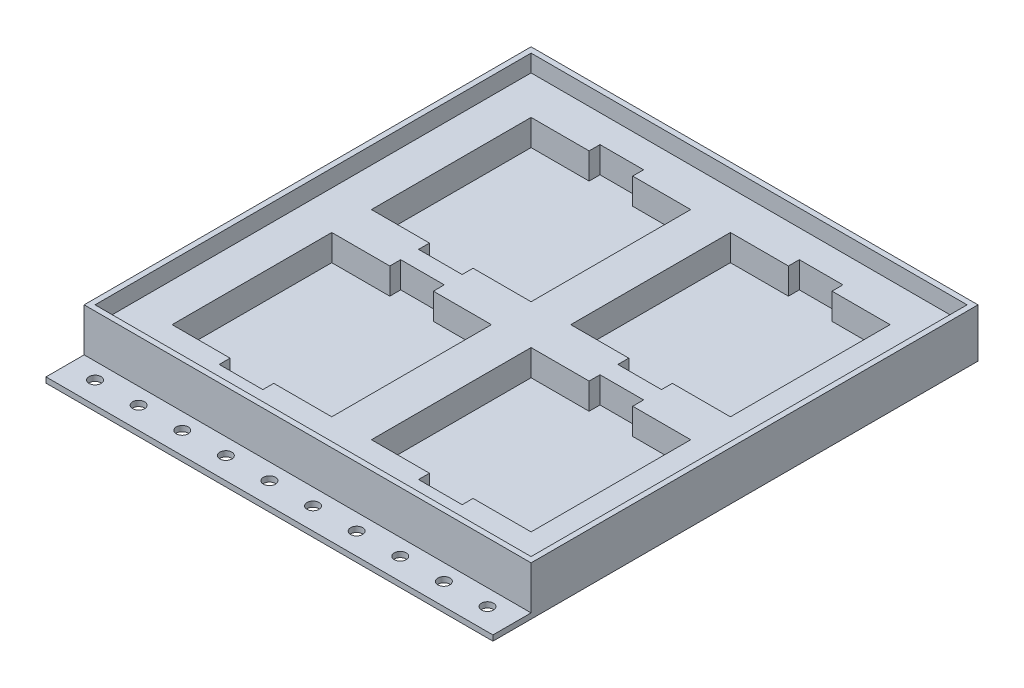
from build123d import *

# Parameters (mm, degrees)
SKETCH1_W           = 304.8
SKETCH1_H           = 304.8
SKETCH1_W_2         = 93
SKETCH1_H_2         = 93
BOSS_EXTRUDE1_DEPTH = 15.24
SKETCH2_W           = 304.8
SKETCH2_H           = 304.8
BOSS_EXTRUDE2_DEPTH = 3.175
SKETCH3_W           = 304.8
SKETCH3_H           = 304.8
SKETCH3_W_2         = 254
SKETCH3_H_2         = 254
BOSS_EXTRUDE3_DEPTH = 10
SKETCH4_OUTSIDE_W   = 393.198
SKETCH4_OUTSIDE_H   = 393.198
SKETCH4_OUTSIDE_W_2 = 260.35
SKETCH4_OUTSIDE_H_2 = 260.35
CUT_EXTRUDE1_DEPTH  = 25.24
SKETCH5_R           = 3.4925
CUT_EXTRUDE2_DEPTH  = 217.999026726
SKETCH6_W           = 25.4
SKETCH6_H           = 6.35
CUT_EXTRUDE3_DEPTH  = 15.24
SKETCH7_W           = 388.208697242
SKETCH7_H           = 185.968986832
CUT_EXTRUDE4_DEPTH  = 323.042618647
SKETCH8_W           = 545.051384684
SKETCH8_H           = 463.265958
CUT_EXTRUDE5_DEPTH  = 323.042618647
SKETCH9_W           = 585.539242267
SKETCH9_H           = 383.639310532
CUT_EXTRUDE6_DEPTH  = 303.729153039


with BuildPart() as part:
    # Sketch1 → Boss-Extrude1 (new body)
    with BuildSketch(Plane(origin=(0, 0, 0), x_dir=(1, 0, 0), z_dir=(0, 1, 0))):
        Rectangle(SKETCH1_W, SKETCH1_H)
        with Locations((58.057, 58.057)):
            Rectangle(SKETCH1_W_2, SKETCH1_H_2, mode=Mode.SUBTRACT)
        with Locations((-58.057, 58.057)):
            Rectangle(SKETCH1_W_2, SKETCH1_H_2, mode=Mode.SUBTRACT)
        with Locations((-58.057, -58.057)):
            Rectangle(SKETCH1_W_2, SKETCH1_H_2, mode=Mode.SUBTRACT)
        with Locations((58.057, -58.057)):
            Rectangle(SKETCH1_W_2, SKETCH1_H_2, mode=Mode.SUBTRACT)
    extrude(amount=BOSS_EXTRUDE1_DEPTH)

    # Sketch2 → Boss-Extrude2 (add)
    with BuildSketch(Plane(origin=(0, 0, 0), x_dir=(-1, 0, 0), z_dir=(0, -1, 0))):
        Rectangle(SKETCH2_W, SKETCH2_H)
    extrude(amount=BOSS_EXTRUDE2_DEPTH)

    # Sketch3 → Boss-Extrude3 (add)
    with BuildSketch(Plane(origin=(0, 15.24, 0), x_dir=(1, 0, 0), z_dir=(0, 1, 0))):
        Rectangle(SKETCH3_W, SKETCH3_H)
        Rectangle(SKETCH3_W_2, SKETCH3_H_2, mode=Mode.SUBTRACT)
    extrude(amount=BOSS_EXTRUDE3_DEPTH)

    # Sketch4 outside → Cut-Extrude1 (cut)
    with BuildSketch(Plane(origin=(0, 25.24, 0), x_dir=(1, 0, 0), z_dir=(0, 1, 0))):
        Rectangle(SKETCH4_OUTSIDE_W, SKETCH4_OUTSIDE_H)
        Rectangle(SKETCH4_OUTSIDE_W_2, SKETCH4_OUTSIDE_H_2, mode=Mode.SUBTRACT)
    extrude(amount=-CUT_EXTRUDE1_DEPTH, mode=Mode.SUBTRACT)

    # Sketch5 → Cut-Extrude2 (cut, through all)
    with BuildSketch(Plane(origin=(0, 0, 0), x_dir=(1, 0, 0), z_dir=(0, 1, 0))):
        with Locations(Location((-139.7, -139.7, 0), (0, 0, 270))):
            Circle(SKETCH5_R)
        with Locations(Location((-114.3, -139.7, 0), (0, 0, 270))):
            Circle(SKETCH5_R)
        with Locations(Location((-88.9, -139.7, 0), (0, 0, 270))):
            Circle(SKETCH5_R)
        with Locations(Location((-63.5, -139.7, 0), (0, 0, 270))):
            Circle(SKETCH5_R)
        with Locations(Location((-38.1, -139.7, 0), (0, 0, 270))):
            Circle(SKETCH5_R)
        with Locations(Location((-12.7, -139.7, 0), (0, 0, 270))):
            Circle(SKETCH5_R)
        with Locations(Location((12.7, -139.7, 0), (0, 0, 270))):
            Circle(SKETCH5_R)
        with Locations(Location((38.1, -139.7, 0), (0, 0, 270))):
            Circle(SKETCH5_R)
        with Locations(Location((63.5, -139.7, 0), (0, 0, 270))):
            Circle(SKETCH5_R)
        with Locations(Location((88.9, -139.7, 0), (0, 0, 270))):
            Circle(SKETCH5_R)
        with Locations(Location((114.3, -139.7, 0), (0, 0, 270))):
            Circle(SKETCH5_R)
        with Locations(Location((139.7, -139.7, 0), (0, 0, 270))):
            Circle(SKETCH5_R)
        with Locations(Location((-139.7, -114.3, 0), (0, 0, 270))):
            Circle(SKETCH5_R)
        with Locations(Location((-139.7, -88.9, 0), (0, 0, 270))):
            Circle(SKETCH5_R)
        with Locations(Location((-139.7, -63.5, 0), (0, 0, 270))):
            Circle(SKETCH5_R)
        with Locations(Location((-139.7, -38.1, 0), (0, 0, 270))):
            Circle(SKETCH5_R)
        with Locations(Location((-139.7, -12.7, 0), (0, 0, 270))):
            Circle(SKETCH5_R)
        with Locations(Location((-139.7, 12.7, 0), (0, 0, 270))):
            Circle(SKETCH5_R)
        with Locations(Location((-139.7, 38.1, 0), (0, 0, 270))):
            Circle(SKETCH5_R)
        with Locations(Location((-139.7, 63.5, 0), (0, 0, 270))):
            Circle(SKETCH5_R)
        with Locations(Location((-139.7, 88.9, 0), (0, 0, 270))):
            Circle(SKETCH5_R)
        with Locations(Location((-139.7, 114.3, 0), (0, 0, 270))):
            Circle(SKETCH5_R)
        with Locations(Location((-139.7, 139.7, 0), (0, 0, 270))):
            Circle(SKETCH5_R)
        with Locations(Location((-114.3, 139.7, 0), (0, 0, 270))):
            Circle(SKETCH5_R)
        with Locations(Location((-88.9, 139.7, 0), (0, 0, 270))):
            Circle(SKETCH5_R)
        with Locations(Location((-63.5, 139.7, 0), (0, 0, 270))):
            Circle(SKETCH5_R)
        with Locations(Location((-38.1, 139.7, 0), (0, 0, 270))):
            Circle(SKETCH5_R)
        with Locations(Location((-12.7, 139.7, 0), (0, 0, 270))):
            Circle(SKETCH5_R)
        with Locations(Location((12.7, 139.7, 0), (0, 0, 270))):
            Circle(SKETCH5_R)
        with Locations(Location((38.1, 139.7, 0), (0, 0, 270))):
            Circle(SKETCH5_R)
        with Locations(Location((63.5, 139.7, 0), (0, 0, 270))):
            Circle(SKETCH5_R)
        with Locations(Location((88.9, 139.7, 0), (0, 0, 270))):
            Circle(SKETCH5_R)
        with Locations(Location((114.3, 139.7, 0), (0, 0, 270))):
            Circle(SKETCH5_R)
        with Locations(Location((139.7, 139.7, 0), (0, 0, 270))):
            Circle(SKETCH5_R)
        with Locations(Location((139.7, 114.3, 0), (0, 0, 270))):
            Circle(SKETCH5_R)
        with Locations(Location((139.7, 88.9, 0), (0, 0, 270))):
            Circle(SKETCH5_R)
        with Locations(Location((139.7, 63.5, 0), (0, 0, 270))):
            Circle(SKETCH5_R)
        with Locations(Location((139.7, 38.1, 0), (0, 0, 270))):
            Circle(SKETCH5_R)
        with Locations(Location((139.7, 12.7, 0), (0, 0, 270))):
            Circle(SKETCH5_R)
        with Locations(Location((139.7, -12.7, 0), (0, 0, 270))):
            Circle(SKETCH5_R)
        with Locations(Location((139.7, -38.1, 0), (0, 0, 270))):
            Circle(SKETCH5_R)
        with Locations(Location((139.7, -63.5, 0), (0, 0, 270))):
            Circle(SKETCH5_R)
        with Locations(Location((139.7, -88.9, 0), (0, 0, 270))):
            Circle(SKETCH5_R)
        with Locations(Location((139.7, -114.3, 0), (0, 0, 270))):
            Circle(SKETCH5_R)
    extrude(amount=-CUT_EXTRUDE2_DEPTH, mode=Mode.SUBTRACT)

    # Sketch6 → Cut-Extrude3 (cut)
    with BuildSketch(Plane(origin=(0, 15.24, 0), x_dir=(1, 0, 0), z_dir=(0, 1, 0))):
        with Locations((-58.057, 107.732)):
            Rectangle(SKETCH6_W, SKETCH6_H)
        with Locations((-58.057, -8.382)):
            Rectangle(SKETCH6_W, SKETCH6_H)
        with Locations((-58.057, 8.382)):
            Rectangle(SKETCH6_W, SKETCH6_H)
        with Locations((-58.057, -107.732)):
            Rectangle(SKETCH6_W, SKETCH6_H)
        with Locations((58.057, -107.732)):
            Rectangle(SKETCH6_W, SKETCH6_H)
        with Locations((58.057, -8.382)):
            Rectangle(SKETCH6_W, SKETCH6_H)
        with Locations((58.057, 8.382)):
            Rectangle(SKETCH6_W, SKETCH6_H)
        with Locations((58.057, 107.732)):
            Rectangle(SKETCH6_W, SKETCH6_H)
    extrude(amount=-CUT_EXTRUDE3_DEPTH, mode=Mode.SUBTRACT)

    # Sketch7 → Cut-Extrude4 (cut, through all)
    with BuildSketch(Plane(origin=(0, 0, -130.175), x_dir=(-1, 0, 0), z_dir=(0, 0, -1))):
        with Locations((-26.237813245, -25.540582214)):
            Rectangle(SKETCH7_W, SKETCH7_H)
    extrude(amount=CUT_EXTRUDE4_DEPTH, mode=Mode.SUBTRACT)

    # Sketch8 → Cut-Extrude5 (cut, through all)
    with BuildSketch(Plane.ZY.offset(130.175)):
        with Locations((35.238029092, 25.908608745)):
            Rectangle(SKETCH8_W, SKETCH8_H)
    extrude(amount=CUT_EXTRUDE5_DEPTH, mode=Mode.SUBTRACT)

    # Sketch9 → Cut-Extrude6 (cut, through all)
    with BuildSketch(Plane(origin=(130.175, 0, 0), x_dir=(0, 0, -1), z_dir=(1, 0, 0))):
        with Locations((26.844145207, 44.758305083)):
            Rectangle(SKETCH9_W, SKETCH9_H)
    extrude(amount=CUT_EXTRUDE6_DEPTH, mode=Mode.SUBTRACT)


solid = part.part
